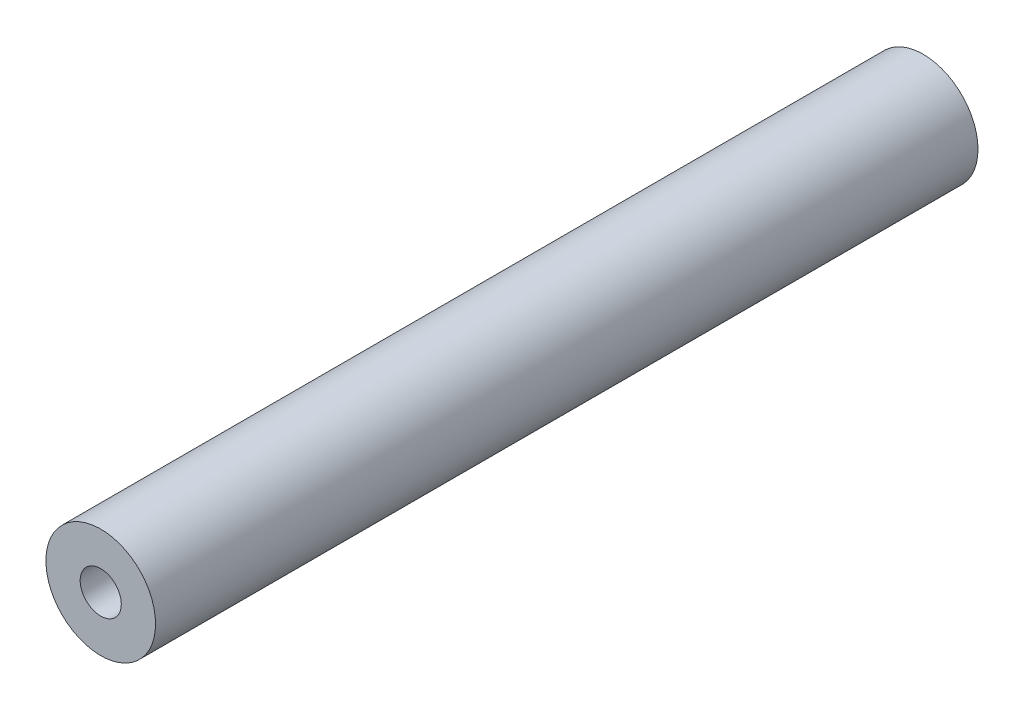
from build123d import *

# Parameters (mm, degrees)
ESQUISSE1_R        = 4
ESQUISSE1_R_2      = 1.5
BOSS_EXTRU_1_DEPTH = 60


with BuildPart() as part:
    # Esquisse1 → Boss.-Extru.1 (new body)
    with BuildSketch(Plane.XY):
        Circle(ESQUISSE1_R)
        Circle(ESQUISSE1_R_2, mode=Mode.SUBTRACT)
    extrude(amount=BOSS_EXTRU_1_DEPTH)


solid = part.part
